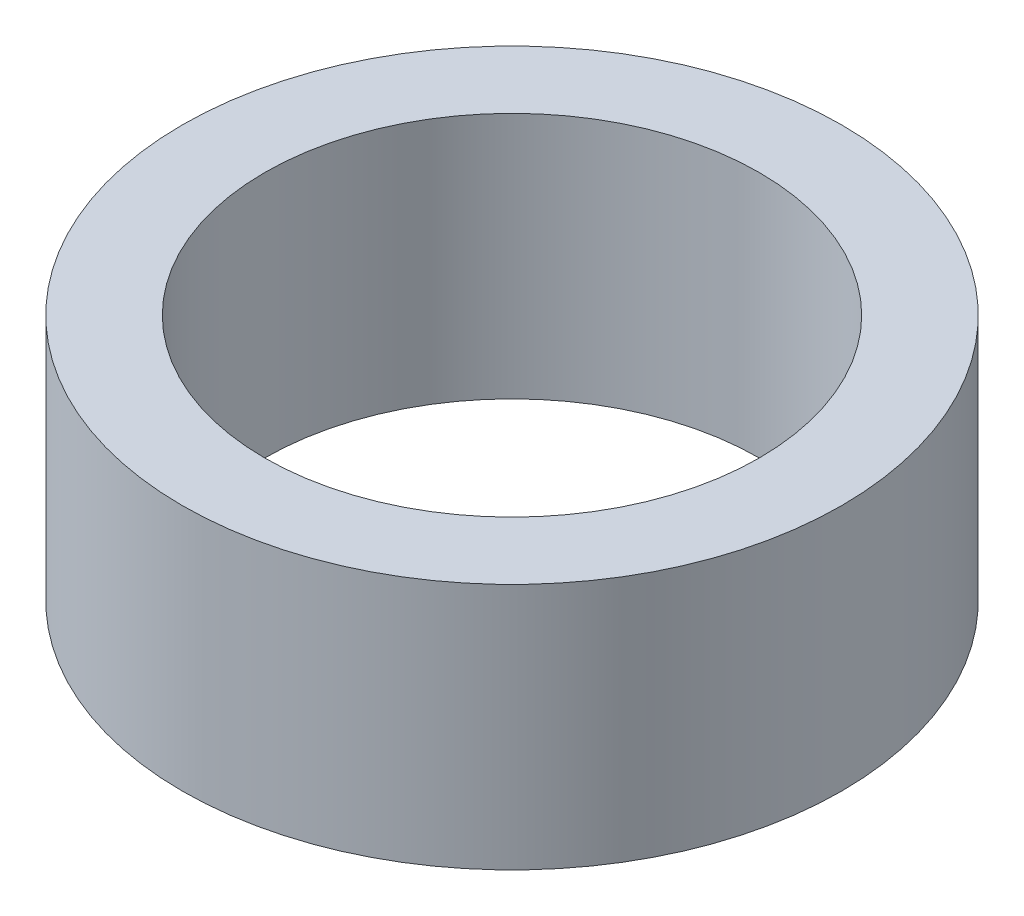
from build123d import *

# Parameters (mm, degrees)
ESQUISSE1_R        = 3
ESQUISSE1_R_2      = 2.25
BOSS_EXTRU_1_DEPTH = 2.25


with BuildPart() as part:
    # Esquisse1 → Boss.-Extru.1 (new body)
    with BuildSketch(Plane(origin=(0, 0, 0), x_dir=(1, 0, 0), z_dir=(0, 1, 0))):
        with Locations(Location((0, 0, 0), (0, 0, 270))):
            Circle(ESQUISSE1_R)
        with Locations(Location((0, 0, 0), (0, 0, 270))):
            Circle(ESQUISSE1_R_2, mode=Mode.SUBTRACT)
    extrude(amount=BOSS_EXTRU_1_DEPTH)


solid = part.part
